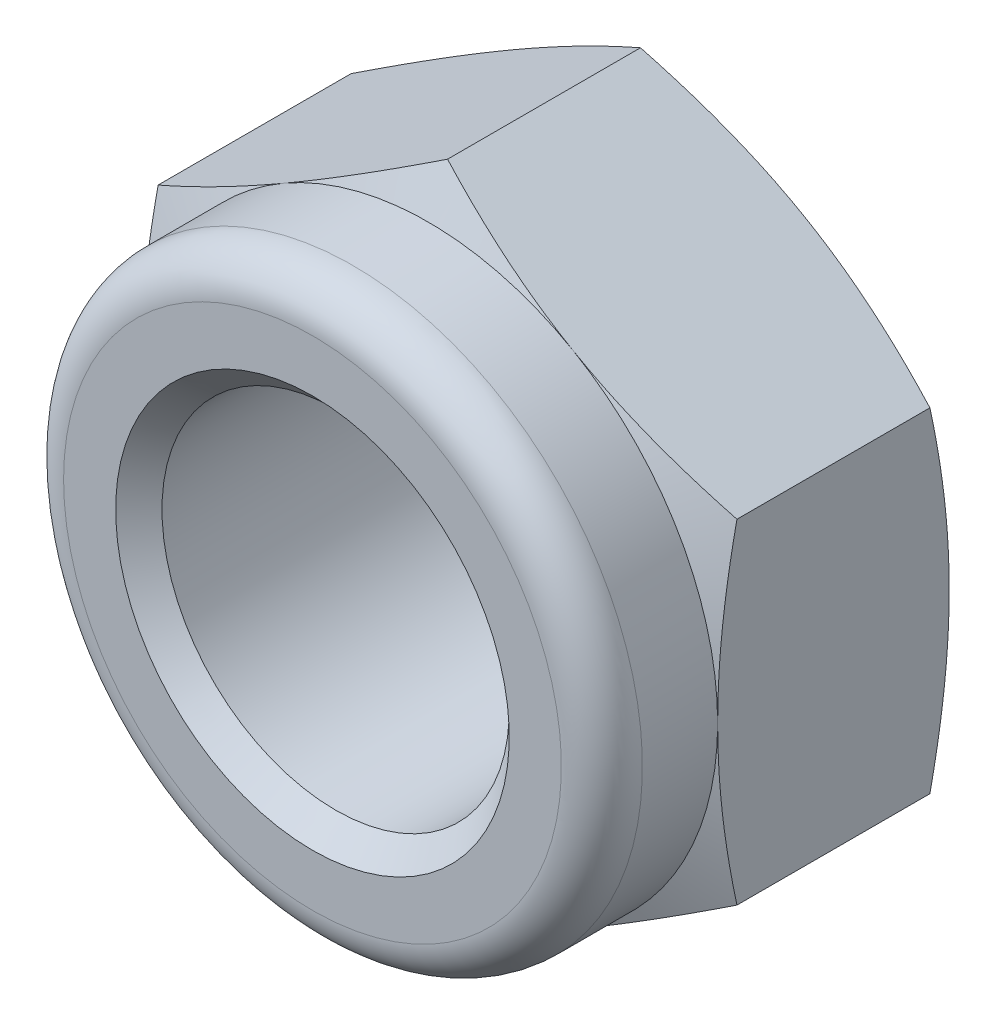
from build123d import *

# Parameters (mm, degrees)
SKETCH1_R           = 3
BOSS_EXTRUDE1_DEPTH = 4


with BuildPart() as part:
    # Sketch1 → Boss-Extrude1 (new body)
    with BuildSketch(Plane.XY):
        Polygon((0, -5.773502692), (5, -2.886751346), (5, 2.886751346), (0, 5.773502692), (-5, 2.886751346), (-5, -2.886751346), align=None)
        Circle(SKETCH1_R, mode=Mode.SUBTRACT)
    extrude(amount=BOSS_EXTRUDE1_DEPTH)

    # Sketch3 → Revolve1 (revolve)
    with BuildSketch(Plane(origin=(0, 0, 0), x_dir=(0, 0, -1), z_dir=(0, 1, 0))):
        with BuildLine():
            Line((-4, 5), (-5.3, 5))
            ThreePointArc((-5.3, 5), (-5.794974747, 4.794974747), (-6, 4.3))
            Line((-6, 4.3), (-6, 3))
            Line((-6, 3), (-4, 3))
            Line((-4, 3), (-4, 5))
        make_face()
    revolve(axis=Axis((0, 0, 0), (0, 0, 1)))

    # Sketch2 → Cut-Revolve1 (revolve, cut)
    with BuildSketch(Plane(origin=(0, 0, 0), x_dir=(0, 0, -1), z_dir=(1, 0, 0))):
        Polygon((-4, 5.773502692), (-4, 5), (-3.666666667, 5.773502692), align=None)
        Polygon((-0.333333333, 5.773502692), (0, 5.773502692), (0, 5), align=None)
        Polygon((-6, 3), (-5.6, 3), (-6, 3.4), align=None)
        Polygon((0, 3), (-0.4, 3), (0, 3.4), align=None)
    revolve(axis=Axis((0, 0, 0), (0, 0, 1)), mode=Mode.SUBTRACT)


solid = part.part
